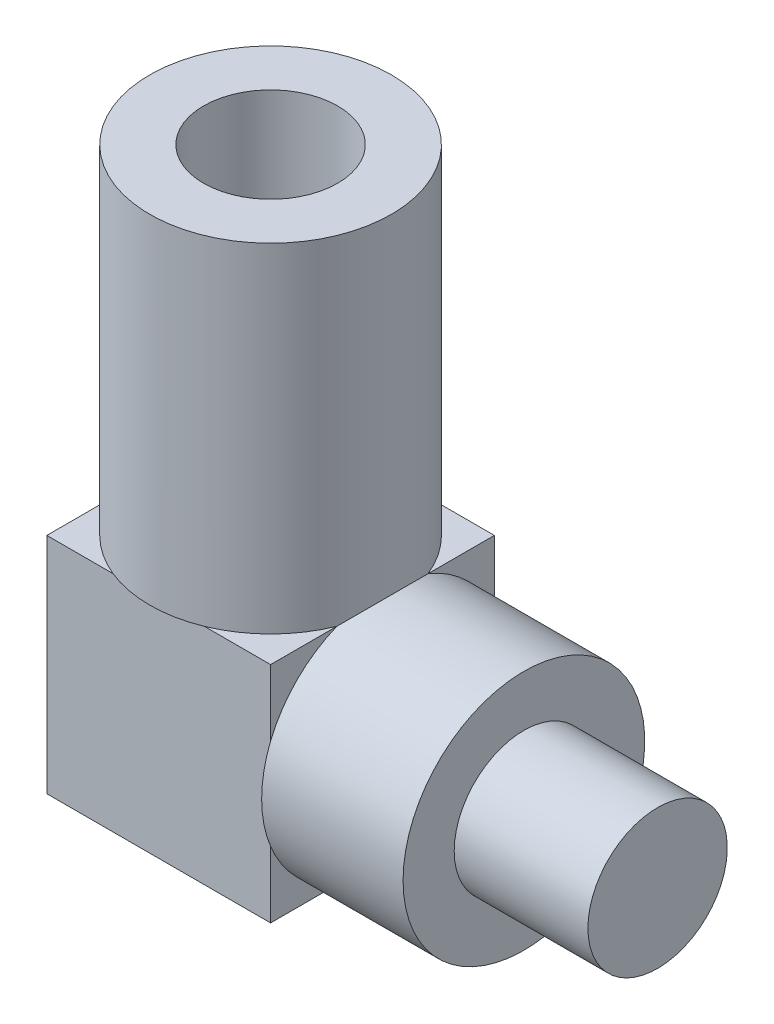
from build123d import *

# Parameters (mm, degrees)
BLOCK_SKETCH_W  = 15.9
BLOCK_SKETCH_H  = 15.9
BLOCK_DEPTH     = 7.95
ARM_SKETCH_W    = 8.586
ARM_SKETCH_H    = 24.05
SOCKET_SKETCH_W = 4.7625
SOCKET_SKETCH_H = 17.8


with BuildPart() as part:
    # Block Sketch → Block (new, symmetric)
    with BuildSketch(Plane.XY):
        with Locations((-18, 0)):
            Rectangle(BLOCK_SKETCH_W, BLOCK_SKETCH_H)
    extrude(amount=BLOCK_DEPTH, both=True)

    # Neck and Stud Sketch → Neck and Stud (revolve)
    with BuildSketch(Plane.XY):
        Polygon((9.5, 0), (9.5, 4.953), (0, 4.953), (0, 8.586), (-10.05, 8.586), (-10.05, 0), align=None)
    revolve(axis=Axis((-1000, 0, 0), (1, 0, 0)))

    # Arm Sketch → Arm (revolve)
    with BuildSketch(Plane.XY):
        with Locations((-13.707, 19.975)):
            Rectangle(ARM_SKETCH_W, ARM_SKETCH_H)
    revolve(axis=Axis((-18, 0, 0), (0, 1, 0)))

    # Socket Sketch → Socket (revolve, cut)
    with BuildSketch(Plane.XY):
        with Locations((-15.61875, 24.1)):
            Rectangle(SOCKET_SKETCH_W, SOCKET_SKETCH_H)
    revolve(axis=Axis((-18, 0, 0), (0, 1, 0)), mode=Mode.SUBTRACT)


solid = part.part
